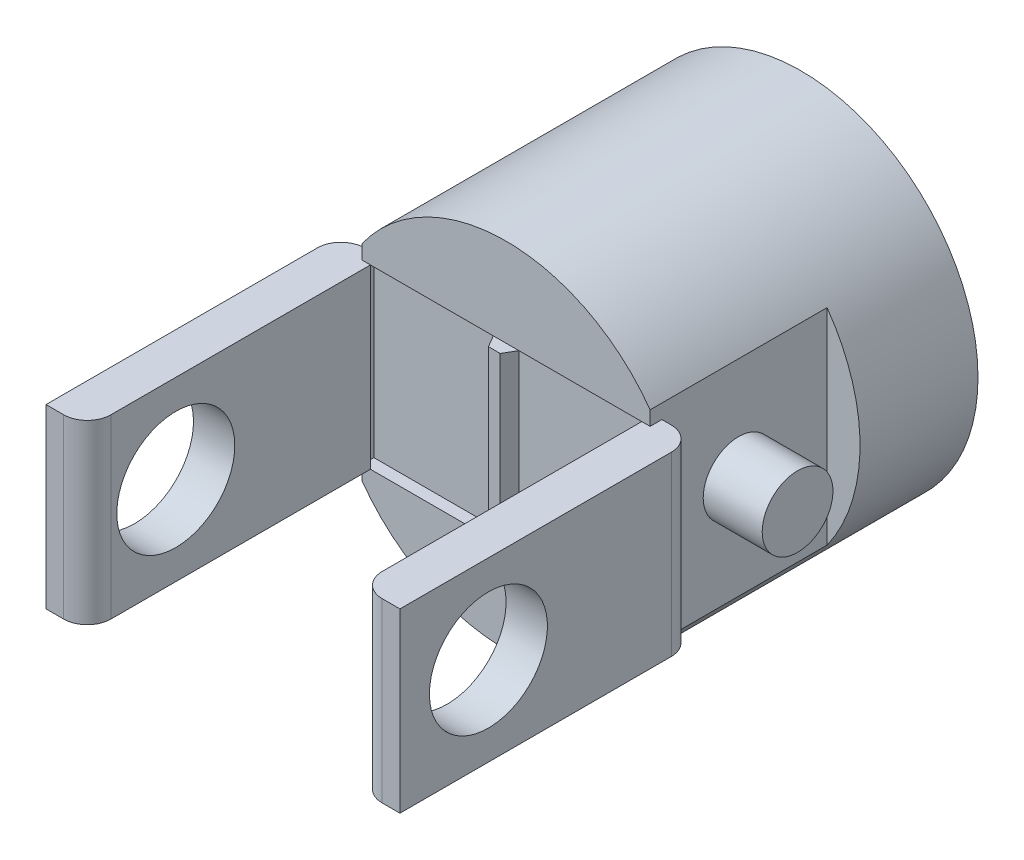
from build123d import *

# Parameters (mm, degrees)
SKETCH1_R           = 30
BOSS_EXTRUDE1_DEPTH = 50
SKETCH2_R           = 23
CUT_EXTRUDE1_DEPTH  = 20
CUT_EXTRUDE2_START  = -30
CUT_EXTRUDE2_DEPTH  = 30
SKETCH5_R           = 6
BOSS_EXTRUDE3_DEPTH = 10
SKETCH6_W           = 48.826406872
SKETCH6_H           = 30
CUT_EXTRUDE3_DEPTH  = 2
BOSS_EXTRUDE4_DEPTH = 30
SKETCH8_R           = 10
CUT_EXTRUDE4_DEPTH  = 122.049827661
FILLET1_R           = 4
FILLET2_R           = 4
BOSS_EXTRUDE5_DEPTH = 10


with BuildPart() as part:
    # Sketch1 → Boss-Extrude1 (new body)
    with BuildSketch(Plane.XY):
        Circle(SKETCH1_R)
    extrude(amount=BOSS_EXTRUDE1_DEPTH)

    # Sketch2 → Cut-Extrude1 (cut)
    with BuildSketch(Plane(origin=(0, 0, 0), x_dir=(-1, 0, 0), z_dir=(0, 0, -1))):
        Circle(SKETCH2_R)
    extrude(amount=-CUT_EXTRUDE1_DEPTH, mode=Mode.SUBTRACT)

    # Sketch3 → Cut-Extrude2 (cut)
    with BuildSketch(Plane.XY.offset(50).offset(CUT_EXTRUDE2_START)):
        with BuildLine():
            Line((-24.413203436, 17.43546667), (-24.413203436, -17.43546667))
            ThreePointArc((-24.413203436, -17.43546667), (-30, 0), (-24.413203436, 17.43546667))
        make_face()
        with BuildLine():
            Line((24.413203436, 17.43546667), (24.413203436, -17.43546667))
            ThreePointArc((24.413203436, -17.43546667), (30, 0), (24.413203436, 17.43546667))
        make_face()
    extrude(amount=CUT_EXTRUDE2_DEPTH, mode=Mode.SUBTRACT)

    # Sketch5 → Boss-Extrude3 (add)
    with BuildSketch(Plane(origin=(24.413203436, 0, 0), x_dir=(0, 0, -1), z_dir=(1, 0, 0))):
        with Locations(Location((-35, 0, 0), (0, 0, 180))):
            Circle(SKETCH5_R)
    extrude(amount=BOSS_EXTRUDE3_DEPTH)

    # Sketch6 → Cut-Extrude3 (cut)
    with BuildSketch(Plane.XY.offset(50)):
        Rectangle(SKETCH6_W, SKETCH6_H)
    extrude(amount=-CUT_EXTRUDE3_DEPTH, mode=Mode.SUBTRACT)

    # Sketch7 → Boss-Extrude4 (add)
    with BuildSketch(Plane.XZ.offset(-15)):
        Polygon((-23, 50), (-23, 98), (-30, 98), (-30, 48), (-24.413203436, 48), (-24.413203436, 50), align=None)
        Polygon((-3.315789474, 48), (-23, 48), (-23, 14), align=None)
        Polygon((-1, 52), (-2.157894737, 50), (2.157894737, 50), (1, 52), align=None)
        Polygon((23, 48), (3.315789474, 48), (23, 14), align=None)
        Polygon((23, 98), (23, 50), (24.413203436, 50), (24.413203436, 48), (30, 48), (30, 98), align=None)
    extrude(amount=BOSS_EXTRUDE4_DEPTH)


with BuildPart() as boss_extrude4_piece_1:
    # of the separate pieces the step leaves, piece 1, a body of its own (boss_extrude4_pieces)
    add(part.part.solids().sort_by_distance((30, 0, 0))[0])

    # Sketch9 → Boss-Extrude5 (add)
    with BuildSketch(Plane(origin=(0, 0, 20), x_dir=(-1, 0, 0), z_dir=(0, 0, -1))):
        with BuildLine():
            Line((0, -11.949874371), (-1, -11.949874371))
            Line((-1, -11.949874371), (-1, -9.949874371))
            ThreePointArc((-1, -9.949874371), (0, 10), (1, -9.949874371))
            Line((1, -9.949874371), (1, -11.949874371))
            Line((1, -11.949874371), (0, -11.949874371))
        make_face()
    extrude(amount=BOSS_EXTRUDE5_DEPTH)


with BuildPart() as boss_extrude4_piece_2:
    # of the separate pieces the step leaves, piece 2, a body of its own (boss_extrude4_pieces)
    add(part.part.solids().sort_by_distance((-23, -15, 98))[0])


with BuildPart() as boss_extrude4_piece_3:
    # of the separate pieces the step leaves, piece 3, a body of its own (boss_extrude4_pieces)
    add(part.part.solids().sort_by_distance((23, -15, 98))[0])


with BuildPart() as boss_extrude4_piece_4:
    # of the separate pieces the step leaves, piece 4, a body of its own (boss_extrude4_pieces)
    add(part.part.solids().sort_by_distance((1, 15, 52))[0])


with BuildPart() as cut_extrude4_tool:
    # Sketch8 → Cut-Extrude4 (new, through all)
    with BuildSketch(Plane.ZY.offset(30)):
        with Locations((83, 0)):
            Circle(SKETCH8_R)
    extrude(amount=-CUT_EXTRUDE4_DEPTH)


with BuildPart() as boss_extrude4_piece_2_1:
    add(boss_extrude4_piece_2.part)

    # Cut-Extrude4: cut by cut_extrude4_tool
    add(cut_extrude4_tool.part, mode=Mode.SUBTRACT)

    # Fillet2
    fillet2_edges = [boss_extrude4_piece_2_1.edges().sort_by_distance(p)[0] for p in [
        (-23, 0, 98),
        (-30, 0, 48),
    ]]
    fillet(fillet2_edges, radius=FILLET2_R)


with BuildPart() as boss_extrude4_piece_3_1:
    add(boss_extrude4_piece_3.part)

    # Cut-Extrude4: cut by cut_extrude4_tool
    add(cut_extrude4_tool.part, mode=Mode.SUBTRACT)

    # Fillet1
    fillet1_edges = [boss_extrude4_piece_3_1.edges().sort_by_distance(p)[0] for p in [
        (30, 0, 48),
        (23, 0, 98),
    ]]
    fillet(fillet1_edges, radius=FILLET1_R)


solid = Compound([boss_extrude4_piece_1.part, boss_extrude4_piece_4.part, boss_extrude4_piece_2_1.part, boss_extrude4_piece_3_1.part])
